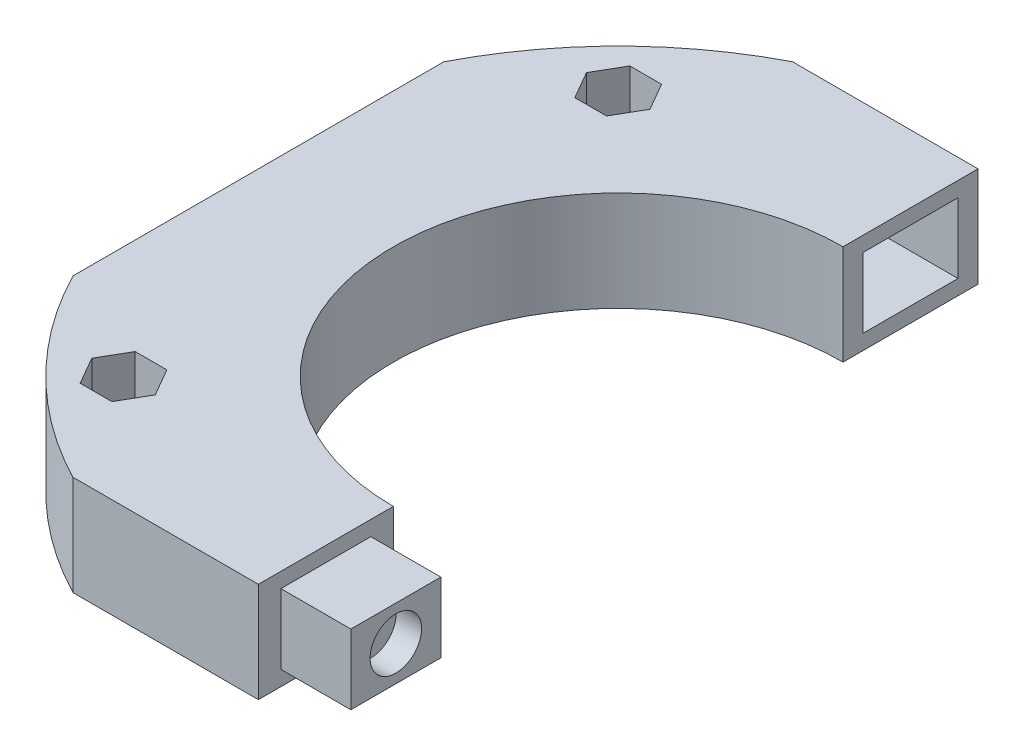
from build123d import *

# Parameters (mm, degrees)
BOSS_EXTRUDE1_DEPTH      = 5
BOSS_EXTRUDE1_DEPTH_BACK = 5
SKETCH1_R                = 1.5
CUT_EXTRUDE1_DEPTH       = 5
BOSS_EXTRUDE2_DEPTH      = 3.5
BOSS_EXTRUDE2_DEPTH_BACK = 3.5
SKETCH3_W                = 7
SKETCH3_H                = 9
CUT_EXTRUDE2_DEPTH       = 3.5
CUT_EXTRUDE2_DEPTH_BACK  = 3.5
SKETCH4_W                = 9.454278837
SKETCH4_H                = 9.5
SKETCH5_R                = 2.575
CUT_EXTRUDE3_DEPTH       = 2.55
SKETCH6_R                = 2.575
CUT_EXTRUDE4_DEPTH       = 2.55


with BuildPart() as part:
    # Sketch1 → Boss-Extrude1 (new, two sides: drawn at the far end of the back side and taken through both)
    with BuildSketch(Plane(origin=(0, 0, 0), x_dir=(1, 0, 0), z_dir=(0, 1, 0)).offset(-BOSS_EXTRUDE1_DEPTH_BACK)):
        with BuildLine():
            Line((0, 22.5), (0, 36))
            Line((0, 36), (-18.553975315, 36))
            ThreePointArc((-18.553975315, 36), (-28.637824638, 28.637824638), (-36, 18.553975315))
            Line((-36, 18.553975315), (-36, -18.553975315))
            ThreePointArc((-36, -18.553975315), (-28.637824638, -28.637824638), (-18.553975315, -36))
            Line((-18.553975315, -36), (0, -36))
            Line((0, -36), (0, -22.5))
            ThreePointArc((0, -22.5), (-22.5, 0), (0, 22.5))
        make_face()
        with Locations((-24.748737342, -24.748737342)):
            Circle(SKETCH1_R, mode=Mode.SUBTRACT)
        with Locations((-24.748737342, 24.748737342)):
            Circle(SKETCH1_R, mode=Mode.SUBTRACT)
    extrude(amount=BOSS_EXTRUDE1_DEPTH + BOSS_EXTRUDE1_DEPTH_BACK)

    # Sketch2 → Cut-Extrude1 (cut)
    with BuildSketch(Plane(origin=(0, 5, 0), x_dir=(1, 0, 0), z_dir=(0, 1, 0))):
        Polygon((-23.161024101, 27.498737342), (-26.336450582, 27.498737342), (-27.924163822, 24.748737342), (-26.336450582, 21.998737342), (-23.161024101, 21.998737342), (-21.573310861, 24.748737342), align=None)
    cut_extrude1 = extrude(amount=-CUT_EXTRUDE1_DEPTH, mode=Mode.SUBTRACT)

    # Mirror1: Cut-Extrude1 across plane
    add(cut_extrude1.mirror(Plane.XY), mode=Mode.SUBTRACT)

    # Sketch3 → Boss-Extrude2 (add, two sides: drawn at the far end of the back side and taken through both)
    with BuildSketch(Plane(origin=(0, 0, 0), x_dir=(1, 0, 0), z_dir=(0, 1, 0)).offset(-BOSS_EXTRUDE2_DEPTH_BACK)):
        with Locations((3.5, -29.25)):
            Rectangle(SKETCH3_W, SKETCH3_H)
    extrude(amount=BOSS_EXTRUDE2_DEPTH + BOSS_EXTRUDE2_DEPTH_BACK)

    # Sketch4 → Cut-Extrude2 (cut, two sides: drawn at the far end of the back side and taken through both)
    with BuildSketch(Plane.XZ.offset(-CUT_EXTRUDE2_DEPTH_BACK)):
        with Locations((-4.727139419, -29.25)):
            Rectangle(SKETCH4_W, SKETCH4_H)
    extrude(amount=CUT_EXTRUDE2_DEPTH + CUT_EXTRUDE2_DEPTH_BACK, mode=Mode.SUBTRACT)

    # Sketch5 → Cut-Extrude3 (cut)
    with BuildSketch(Plane(origin=(7, 0, 0), x_dir=(0, 0, -1), z_dir=(1, 0, 0))):
        with Locations((-29.25, 0)):
            Circle(SKETCH5_R)
    extrude(amount=-CUT_EXTRUDE3_DEPTH, mode=Mode.SUBTRACT)

    # Sketch6 → Cut-Extrude4 (cut)
    with BuildSketch(Plane(origin=(-9.454278837, 0, 0), x_dir=(0, 0, -1), z_dir=(1, 0, 0))):
        with Locations((29.25, 0)):
            Circle(SKETCH6_R)
    extrude(amount=-CUT_EXTRUDE4_DEPTH, mode=Mode.SUBTRACT)


solid = part.part
